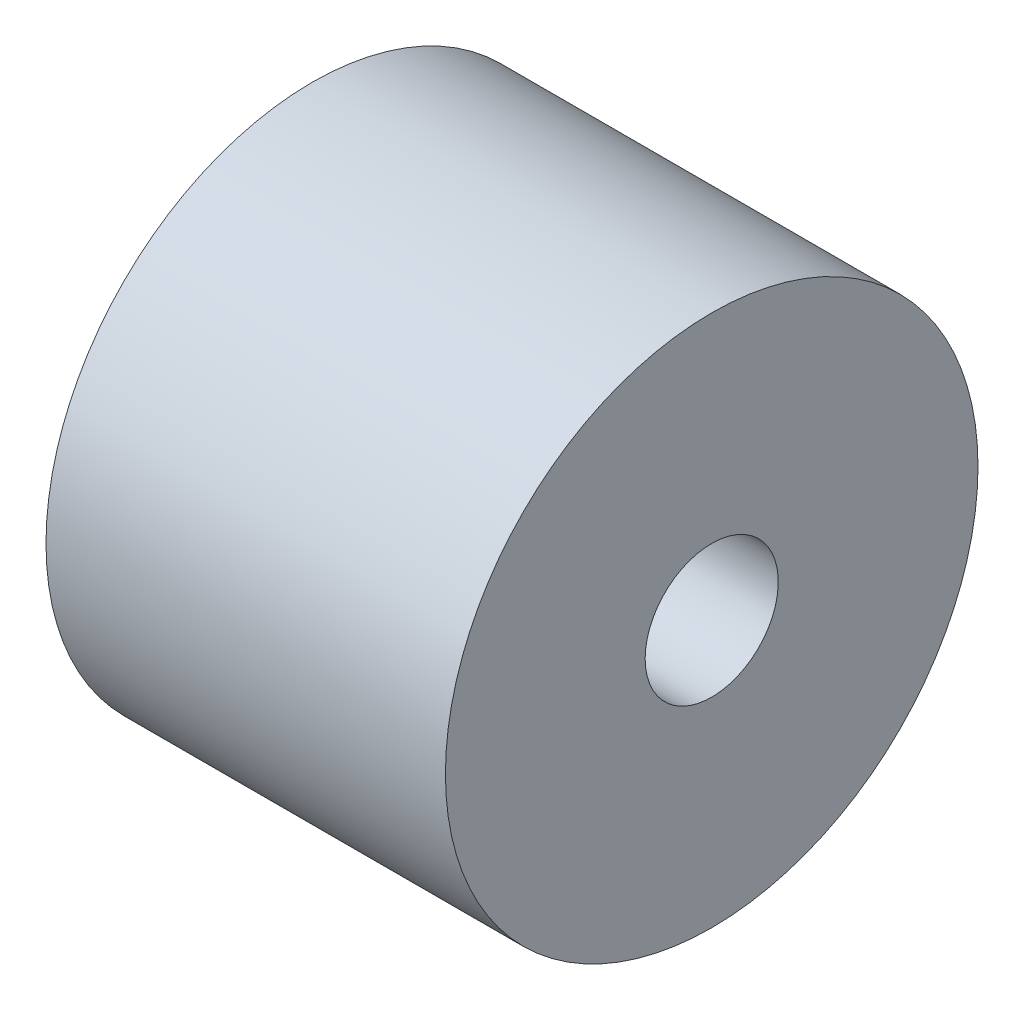
from build123d import *

# Parameters (mm, degrees)
GROMMET_IMU_SKETCH_W = 6
GROMMET_IMU_SKETCH_H = 3


with BuildPart() as part:
    # Grommet_IMU Sketch → Grommet_IMU (revolve)
    with BuildSketch(Plane.XY):
        with Locations((3, 2.5)):
            Rectangle(GROMMET_IMU_SKETCH_W, GROMMET_IMU_SKETCH_H)
    revolve(axis=Axis((-400, 0, 0), (1, 0, 0)))


solid = part.part
